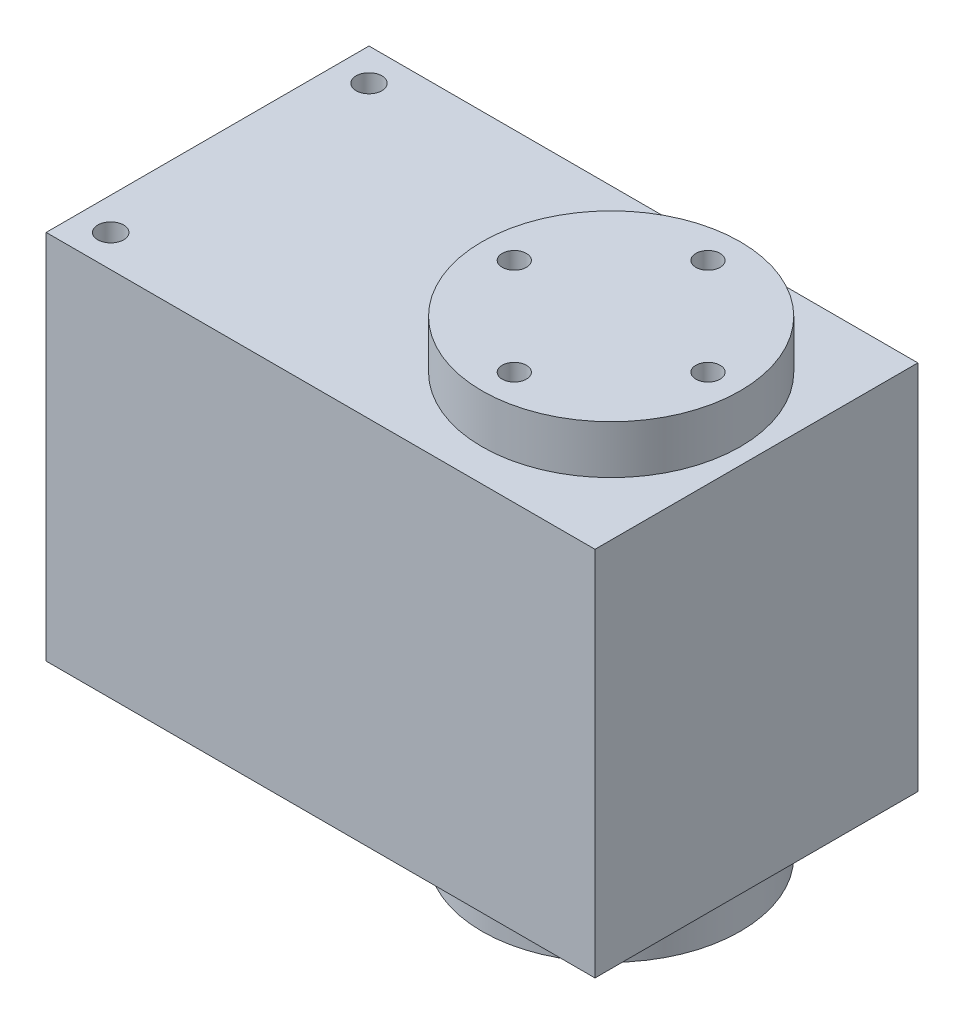
from build123d import *

# Parameters (mm, degrees)
SKETCH_1_W               = 20
SKETCH_1_H               = 23
EXTRUDE_1_DEPTH          = 34
CUT_EXTRUDE_1_DEPTH      = 10
CUT_EXTRUDE_1_DEPTH_BACK = 34
SKETCH_2_R               = 0.8
SKETCH_3_R               = 8
EXTRUDE_2_DEPTH          = 3
SKETCH_4_R               = 0.75
CUT_EXTRUDE_2_DEPTH      = 3


with BuildPart() as part:
    # 草图1 → 凸台-拉伸1 (new body)
    with BuildSketch(Plane(origin=(0, 0, 0), x_dir=(0, 0, -1), z_dir=(1, 0, 0))):
        Rectangle(SKETCH_1_W, SKETCH_1_H)
    extrude(amount=EXTRUDE_1_DEPTH)

    # 草图2 → 切除-拉伸1 (cut, two sides: drawn at the far end of the back side and taken through both)
    with BuildSketch(Plane(origin=(0, -11.5, 0), x_dir=(-1, 0, 0), z_dir=(0, -1, 0)).offset(-CUT_EXTRUDE_1_DEPTH_BACK)):
        with Locations(Location((-2, -8, 0), (0, 0, 270))):
            Circle(SKETCH_2_R)
        with Locations(Location((-2, 8, 0), (0, 0, 270))):
            Circle(SKETCH_2_R)
    extrude(amount=CUT_EXTRUDE_1_DEPTH + CUT_EXTRUDE_1_DEPTH_BACK, mode=Mode.SUBTRACT)

    # 草图3 → 凸台-拉伸2 (add)
    with BuildSketch(Plane(origin=(0, 11.5, 0), x_dir=(1, 0, 0), z_dir=(0, 1, 0))):
        with Locations(Location((25, 0, 0), (0, 0, 90))):
            Circle(SKETCH_3_R)
    extrude_2 = extrude(amount=EXTRUDE_2_DEPTH)

    # 镜向1: 凸台-拉伸2 across plane
    add(extrude_2.mirror(Plane.ZX))

    # 草图4 → 切除-拉伸2 (cut)
    with BuildSketch(Plane(origin=(0, 14.5, 0), x_dir=(1, 0, 0), z_dir=(0, 1, 0))):
        with Locations(Location((25, -6, 0), (0, 0, 270))):
            Circle(SKETCH_4_R)
        with Locations((45.5, 14.5)):
            Circle(SKETCH_4_R)
        with Locations((25, 35)):
            Circle(SKETCH_4_R)
        with Locations((4.5, 14.5)):
            Circle(SKETCH_4_R)
        with Locations(Location((19, 0, 0), (0, 0, 270))):
            Circle(SKETCH_4_R)
        with Locations(Location((25, 6, 0), (0, 0, 270))):
            Circle(SKETCH_4_R)
        with Locations(Location((31, 0, 0), (0, 0, 270))):
            Circle(SKETCH_4_R)
    cut_extrude_2 = extrude(amount=-CUT_EXTRUDE_2_DEPTH, mode=Mode.SUBTRACT)

    # 镜向2: 切除-拉伸2 across plane
    add(cut_extrude_2.mirror(Plane.ZX), mode=Mode.SUBTRACT)


solid = part.part
